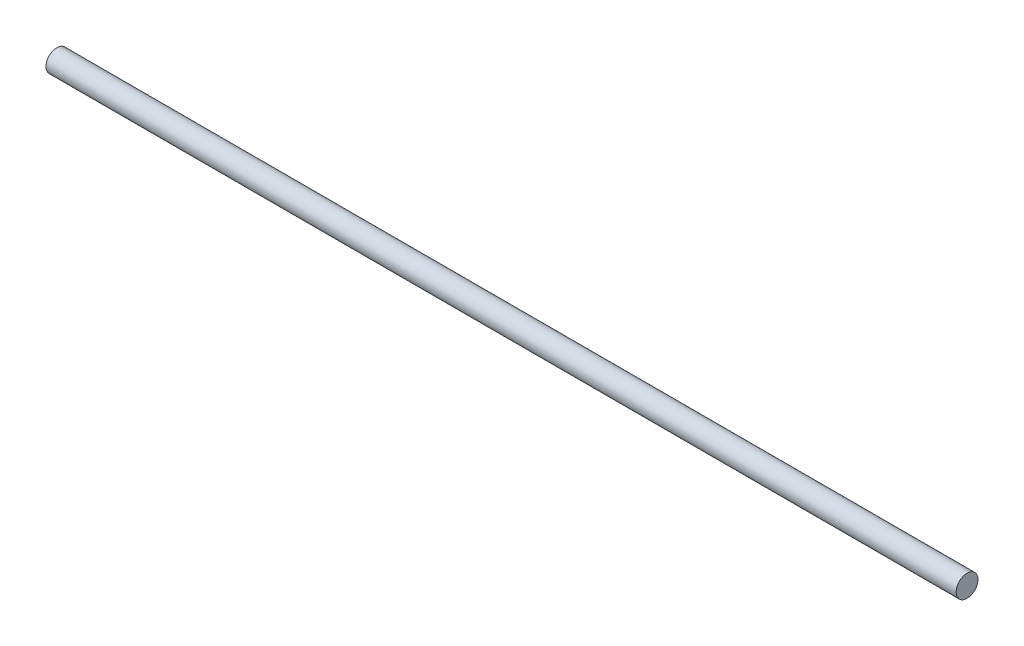
from build123d import *

# Parameters (mm, degrees)
SKETCH1_R           = 6
BOSS_EXTRUDE1_DEPTH = 500


with BuildPart() as part:
    # Sketch1 → Boss-Extrude1 (new body)
    with BuildSketch(Plane(origin=(0, 0, 0), x_dir=(0, 0, -1), z_dir=(1, 0, 0))):
        Circle(SKETCH1_R)
    extrude(amount=BOSS_EXTRUDE1_DEPTH)


solid = part.part
